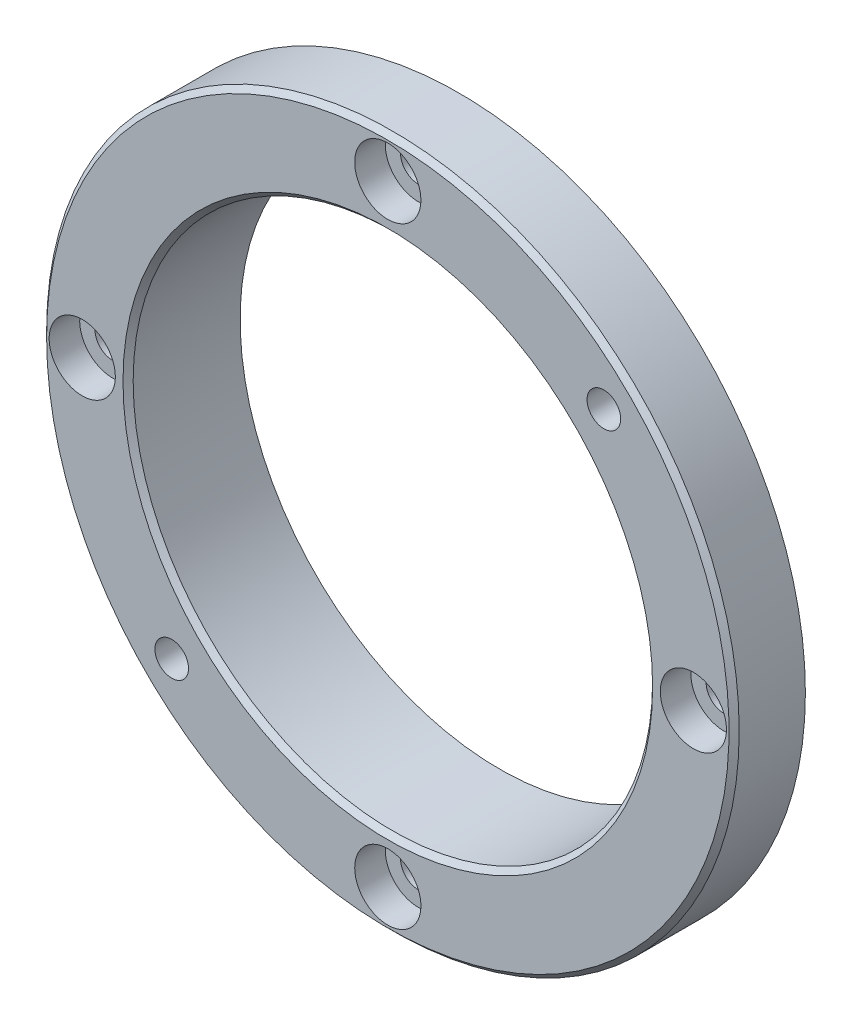
from build123d import *

# Parameters (mm, degrees)
HOLE_WIZARD_M4_1_D       = 3.3
SKETCH_4_R               = 3.25
CUT_EXTRUDE_1_DEPTH      = 3
SKETCH_5_R               = 1.75
CUT_EXTRUDE_2_DEPTH      = 49.744230428
PATTERN_CIRCULAR_1_COUNT = 4
CHAMFER_1_SIZE           = 0.5


with BuildPart() as part:
    # 草圖1 → 旋轉1 (revolve)
    with BuildSketch(Plane(origin=(0, 0, 0), x_dir=(0, 0, -1), z_dir=(1, 0, 0)), mode=Mode.PRIVATE) as revolve_1_sk:
        Polygon((0, 25.5), (0, 34), (7, 34), (7, 27), (11, 27), (11, 25.5), align=None)
    revolve(revolve_1_sk.sketch.rotate(Axis((0, 0, 0), (0, 0, -1)), 90), axis=Axis((0, 0, 0), (0, 0, -1)))

    # M4 螺紋孔1 (through all)
    with Locations(Plane.XY):
        with Locations((21.213203436, 21.213203436), (-21.213203436, -21.213203436)):
            Hole(HOLE_WIZARD_M4_1_D / 2)

    # 草圖4 → 伸長1 (cut)
    with BuildSketch(Plane.XY):
        with Locations((0, 30)):
            Circle(SKETCH_4_R)
    cut_extrude_1 = extrude(amount=-CUT_EXTRUDE_1_DEPTH, mode=Mode.SUBTRACT)

    # 草圖5 → 伸長2 (cut, through all)
    with BuildSketch(Plane.XY.offset(-3)):
        with Locations((0, 30)):
            Circle(SKETCH_5_R)
    cut_extrude_2 = extrude(amount=-CUT_EXTRUDE_2_DEPTH, mode=Mode.SUBTRACT)

    # 環狀複製排列1: 伸長1, 伸長2 ×4 about axis
    pattern_circular_1_axis = Axis((0, 0, 0), (0, 0, 1))
    add([cut_extrude_1.rotate(pattern_circular_1_axis, i * 360 / PATTERN_CIRCULAR_1_COUNT) for i in range(1, PATTERN_CIRCULAR_1_COUNT)], mode=Mode.SUBTRACT)
    add([cut_extrude_2.rotate(pattern_circular_1_axis, i * 360 / PATTERN_CIRCULAR_1_COUNT) for i in range(1, PATTERN_CIRCULAR_1_COUNT)], mode=Mode.SUBTRACT)

    # 導角1
    chamfer_1_edges = [part.edges().sort_by_distance(p)[0] for p in [
        (-34, 0, 0),
        (-25.5, 0, 0),
        (-27, 0, -11),
    ]]
    chamfer(chamfer_1_edges, length=CHAMFER_1_SIZE)


solid = part.part
